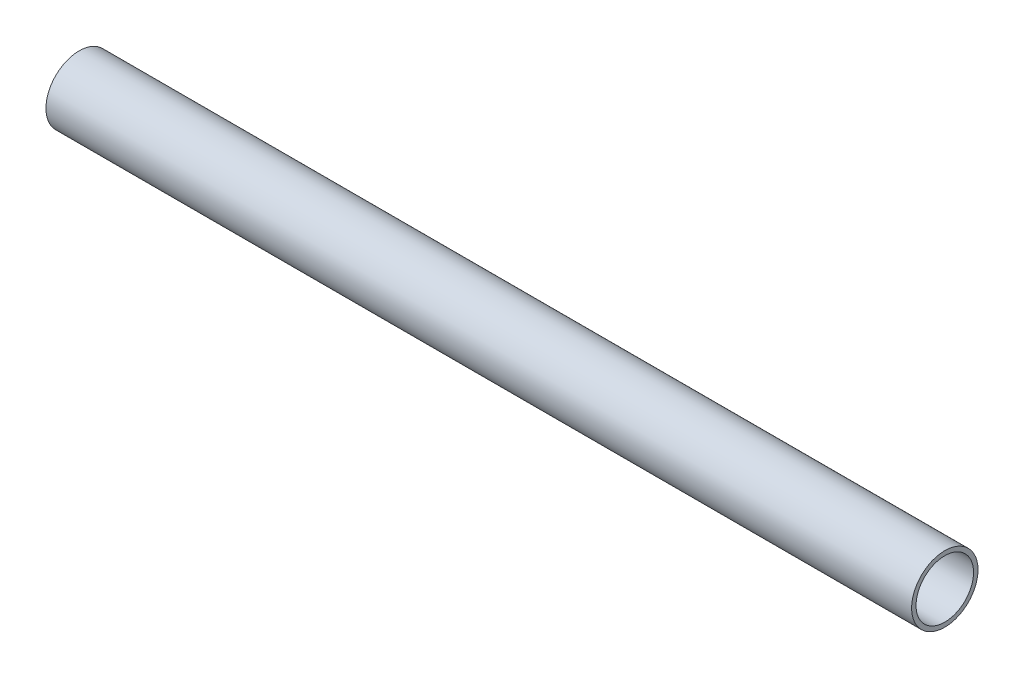
from build123d import *

# Parameters (mm, degrees)
SKETCH_1_R      = 7.5
SKETCH_1_R_2    = 6.5
EXTRUDE_1_DEPTH = 195.58


with BuildPart() as part:
    # 草图1 → 凸台-拉伸1 (new body)
    with BuildSketch(Plane(origin=(0, 0, 0), x_dir=(0, 0, -1), z_dir=(1, 0, 0))):
        Circle(SKETCH_1_R)
        Circle(SKETCH_1_R_2, mode=Mode.SUBTRACT)
    extrude(amount=EXTRUDE_1_DEPTH)


solid = part.part
